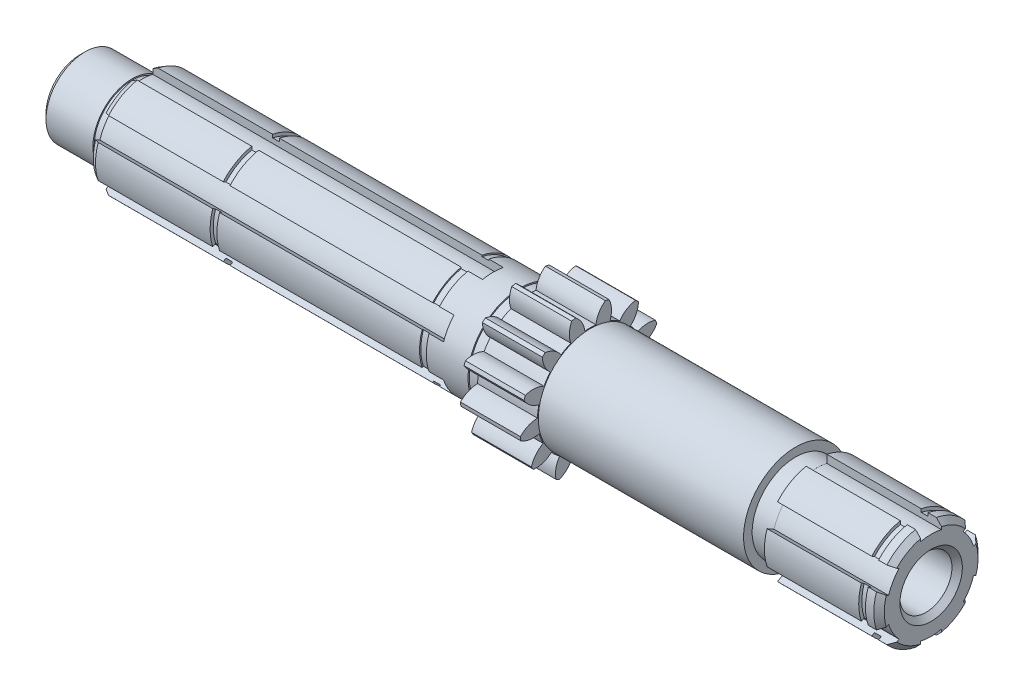
from build123d import *
from OCP.BRepFilletAPI import BRepFilletAPI_MakeChamfer

# Parameters (mm, degrees)
EXTRUDE_1_DEPTH     = 11.5
CUT_EXTRUDE_START   = -67.3
CUT_EXTRUDE_3_DEPTH = 67.3
CUT_EXTRUDE_4_DEPTH = 22
SKETCH_8_R          = 4
CUT_EXTRUDE_5_DEPTH = 165.506790732
SKETCH_9_R          = 5
CUT_EXTRUDE_7_DEPTH = 78.9
CHAMFER_1_SIZE      = 1
CHAMFER_2_SIZE      = 1
CHAMFER_3_SIZE      = 1
CHAMFER_3_SIZE2     = 0.577350269
SKETCH_10_R         = 1
CUT_EXTRUDE_8_DEPTH = 10


with BuildPart() as part:
    # 草图1 → 旋转1 (revolve)
    with BuildSketch(Plane.XY, mode=Mode.PRIVATE) as revolve_1_sk:
        Polygon((-80.983446533, 0), (-80.983446533, 7.5), (-70.983446533, 7.5), (-70.983446533, 7.25), (-68.983446533, 7.25), (-68.983446533, 10), (-45.983446533, 10), (-45.983446533, 9.4), (-44.683446533, 9.4), (-44.683446533, 10), (-5.783446533, 10), (-5.783446533, 9.75), (-4.483446533, 9.75), (-4.483446533, 10), (3.516553467, 10), (3.516553467, 9.75), (5.516553467, 9.75), (5.516553467, 0), align=None)
    revolve(revolve_1_sk.sketch.rotate(Axis((-46.880842637, 0, 0), (1, 0, 0)), 90), axis=Axis((-46.880842637, 0, 0), (1, 0, 0)))

    # 草图4 → 凸台-拉伸1 (add)
    with BuildSketch(Plane(origin=(5.516553467, 0, 0), x_dir=(0, 0, -1), z_dir=(1, 0, 0))):
        with BuildLine():
            ThreePointArc((2.866352313, 13.192195587), (1.644234537, 11.829106862), (1.058280139, 10.094678952))
            ThreePointArc((1.058280139, 10.094678952), (0, 10.15), (-1.058280139, 10.094678952))
            ThreePointArc((-1.058280139, 10.094678952), (-1.644234537, 11.829106862), (-2.866352313, 13.192195587))
            ThreePointArc((-2.866352313, 13.192195587), (-3.230761468, 13.107714535), (-3.592690052, 13.013169414))
            ThreePointArc((-3.592690052, 13.013169414), (-4.041362685, 11.238267839), (-3.754170697, 9.430201608))
            ThreePointArc((-3.754170697, 9.430201608), (-4.716940196, 8.98737866), (-5.62829175, 8.446587002))
            ThreePointArc((-5.62829175, 8.446587002), (-6.953157442, 9.710040059), (-8.668747907, 10.349048735))
            ThreePointArc((-8.668747907, 10.349048735), (-8.952155886, 10.1048951), (-9.228690423, 9.852982953))
            ThreePointArc((-9.228690423, 9.852982953), (-8.80113242, 8.072877089), (-7.70658627, 6.605378723))
            ThreePointArc((-7.70658627, 6.605378723), (-8.353286239, 5.765857179), (-8.908929548, 4.863483762))
            ThreePointArc((-8.908929548, 4.863483762), (-10.669195771, 5.366520098), (-12.485237825, 5.135059538))
            ThreePointArc((-12.485237825, 5.135059538), (-12.622719276, 4.787165975), (-12.750509036, 4.435596839))
            ThreePointArc((-12.750509036, 4.435596839), (-11.544668782, 3.058087488), (-9.893515802, 2.267343175))
            ThreePointArc((-9.893515802, 2.267343175), (-10.075995072, 1.223447305), (-10.148638952, 0.166215004))
            ThreePointArc((-10.148638952, 0.166215004), (-11.941049927, -0.206404945), (-13.441510221, -1.255309916))
            ThreePointArc((-13.441510221, -1.255309916), (-13.4015698, -1.627245183), (-13.351339689, -1.997931056))
            ThreePointArc((-13.351339689, -1.997931056), (-11.643460655, -2.657273104), (-9.813960094, -2.59011337))
            ThreePointArc((-9.813960094, -2.59011337), (-9.490414863, -3.599239603), (-9.063417476, -4.569131609))
            ThreePointArc((-9.063417476, -4.569131609), (-10.47735345, -5.732045102), (-11.318494613, -7.358102996))
            ThreePointArc((-11.318494613, -7.358102996), (-11.11028219, -7.668874081), (-10.89353932, -7.973757024))
            ThreePointArc((-10.89353932, -7.973757024), (-9.074876011, -7.76388445), (-7.4861444, -6.854206156))
            ThreePointArc((-7.4861444, -6.854206156), (-6.730694981, -7.597384094), (-5.901876282, -8.257745234))
            ThreePointArc((-5.901876282, -8.257745234), (-6.613421563, -9.944542805), (-6.602548292, -11.775243354))
            ThreePointArc((-6.602548292, -11.775243354), (-6.273762823, -11.953656346), (-5.940160375, -12.122891352))
            ThreePointArc((-5.940160375, -12.122891352), (-4.427346636, -11.091883435), (-3.443343241, -9.548082914))
            ThreePointArc((-3.443343241, -9.548082914), (-2.429053993, -9.855059447), (-1.388286357, -10.054608943))
            ThreePointArc((-1.388286357, -10.054608943), (-1.234434497, -11.878865596), (-0.374037726, -13.494817367))
            ThreePointArc((-0.374037726, -13.494817367), (0, -13.5), (0.374037726, -13.494817367))
            ThreePointArc((0.374037726, -13.494817367), (1.234434497, -11.878865596), (1.388286357, -10.054608943))
            ThreePointArc((1.388286357, -10.054608943), (2.429053993, -9.855059447), (3.443343241, -9.548082914))
            ThreePointArc((3.443343241, -9.548082914), (4.427346636, -11.091883435), (5.940160375, -12.122891352))
            ThreePointArc((5.940160375, -12.122891352), (6.273762823, -11.953656346), (6.602548292, -11.775243354))
            ThreePointArc((6.602548292, -11.775243354), (6.613421563, -9.944542805), (5.901876282, -8.257745234))
            ThreePointArc((5.901876282, -8.257745234), (6.730694981, -7.597384094), (7.4861444, -6.854206156))
            ThreePointArc((7.4861444, -6.854206156), (9.074876011, -7.76388445), (10.89353932, -7.973757024))
            ThreePointArc((10.89353932, -7.973757024), (11.11028219, -7.668874081), (11.318494613, -7.358102996))
            ThreePointArc((11.318494613, -7.358102996), (10.47735345, -5.732045102), (9.063417476, -4.569131609))
            ThreePointArc((9.063417476, -4.569131609), (9.490414863, -3.599239603), (9.813960094, -2.59011337))
            ThreePointArc((9.813960094, -2.59011337), (11.643460655, -2.657273104), (13.351339689, -1.997931056))
            ThreePointArc((13.351339689, -1.997931056), (13.4015698, -1.627245183), (13.441510221, -1.255309916))
            ThreePointArc((13.441510221, -1.255309916), (11.941049927, -0.206404945), (10.148638952, 0.166215004))
            ThreePointArc((10.148638952, 0.166215004), (10.075995072, 1.223447305), (9.893515802, 2.267343175))
            ThreePointArc((9.893515802, 2.267343175), (11.544668782, 3.058087488), (12.750509036, 4.435596839))
            ThreePointArc((12.750509036, 4.435596839), (12.622719276, 4.787165975), (12.485237825, 5.135059538))
            ThreePointArc((12.485237825, 5.135059538), (10.669195771, 5.366520098), (8.908929548, 4.863483762))
            ThreePointArc((8.908929548, 4.863483762), (8.353286239, 5.765857179), (7.70658627, 6.605378723))
            ThreePointArc((7.70658627, 6.605378723), (8.80113242, 8.072877089), (9.228690423, 9.852982953))
            ThreePointArc((9.228690423, 9.852982953), (8.952155886, 10.1048951), (8.668747907, 10.349048735))
            ThreePointArc((8.668747907, 10.349048735), (6.953157442, 9.710040059), (5.62829175, 8.446587002))
            ThreePointArc((5.62829175, 8.446587002), (4.716940196, 8.98737866), (3.754170697, 9.430201608))
            ThreePointArc((3.754170697, 9.430201608), (4.041362685, 11.238267839), (3.592690052, 13.013169414))
            ThreePointArc((3.592690052, 13.013169414), (3.230761468, 13.107714535), (2.866352313, 13.192195587))
        make_face()
    extrude(amount=EXTRUDE_1_DEPTH)

    # 草图5 → 旋转2 (revolve)
    with BuildSketch(Plane.XY, mode=Mode.PRIVATE) as revolve_2_sk:
        Polygon((12.003531279, 0), (17.016553467, 9.749991304), (14.016553467, 9.749991304), (14.016553467, 9.999991304), (56.416553467, 9.999991304), (56.416553467, 8.349991304), (60.416553467, 8.349991304), (60.416553467, 9.999991304), (78.516553467, 9.999991304), (78.516553467, 9.399991304), (79.816553467, 9.399991304), (79.816553467, 9.999991304), (82.416553467, 9.999991304), (82.416553467, 0), align=None)
    revolve(revolve_2_sk.sketch.rotate(Axis((82.416553467, 0, 0), (-1, 0, 0)), 90), axis=Axis((82.416553467, 0, 0), (-1, 0, 0)))

    # 草图6 → 切除-拉伸3 (cut)
    with BuildSketch(Plane.ZY.offset(68.983446533).offset(CUT_EXTRUDE_START)):
        with BuildLine():
            Line((7.485281374, 6.631030293), (6.154544011, 5.862728718))
            ThreePointArc((6.154544011, 5.862728718), (7.361215932, 4.25), (8.154544011, 2.398627103))
            Line((8.154544011, 2.398627103), (9.485281374, 3.166928678))
            ThreePointArc((9.485281374, 3.166928678), (8.660254038, 5), (7.485281374, 6.631030293))
        make_face()
        with BuildLine():
            Line((-2, 9.797958971), (-2, 8.261355821))
            ThreePointArc((-2, 8.261355821), (0, 8.5), (2, 8.261355821))
            Line((2, 8.261355821), (2, 9.797958971))
            ThreePointArc((2, 9.797958971), (0, 10), (-2, 9.797958971))
        make_face()
        with BuildLine():
            Line((9.485281374, -3.166928678), (8.154544011, -2.398627103))
            ThreePointArc((8.154544011, -2.398627103), (7.361215932, -4.25), (6.154544011, -5.862728718))
            Line((6.154544011, -5.862728718), (7.485281374, -6.631030293))
            ThreePointArc((7.485281374, -6.631030293), (8.660254038, -5), (9.485281374, -3.166928678))
        make_face()
        with BuildLine():
            Line((2, -9.797958971), (2, -8.261355821))
            ThreePointArc((2, -8.261355821), (0, -8.5), (-2, -8.261355821))
            Line((-2, -8.261355821), (-2, -9.797958971))
            ThreePointArc((-2, -9.797958971), (0, -10), (2, -9.797958971))
        make_face()
        with BuildLine():
            Line((-7.485281374, -6.631030293), (-6.154544011, -5.862728718))
            ThreePointArc((-6.154544011, -5.862728718), (-7.361215932, -4.25), (-8.154544011, -2.398627103))
            Line((-8.154544011, -2.398627103), (-9.485281374, -3.166928678))
            ThreePointArc((-9.485281374, -3.166928678), (-8.660254038, -5), (-7.485281374, -6.631030293))
        make_face()
        with BuildLine():
            Line((-9.485281374, 3.166928678), (-8.154544011, 2.398627103))
            ThreePointArc((-8.154544011, 2.398627103), (-7.361215932, 4.25), (-6.154544011, 5.862728718))
            Line((-6.154544011, 5.862728718), (-7.485281374, 6.631030293))
            ThreePointArc((-7.485281374, 6.631030293), (-8.660254038, 5), (-9.485281374, 3.166928678))
        make_face()
    extrude(amount=CUT_EXTRUDE_3_DEPTH, mode=Mode.SUBTRACT)

    # 草图7 → 切除-拉伸4 (cut)
    with BuildSketch(Plane(origin=(82.416553467, 0, 0), x_dir=(0, 0, -1), z_dir=(1, 0, 0))):
        with BuildLine():
            Line((7.485281374, 6.631030293), (6.154544011, 5.862728718))
            ThreePointArc((6.154544011, 5.862728718), (7.361215932, 4.25), (8.154544011, 2.398627103))
            Line((8.154544011, 2.398627103), (9.485281374, 3.166928678))
            ThreePointArc((9.485281374, 3.166928678), (8.660254038, 5), (7.485281374, 6.631030293))
        make_face()
        with BuildLine():
            Line((-2, 9.797958971), (-2, 8.261355821))
            ThreePointArc((-2, 8.261355821), (0, 8.5), (2, 8.261355821))
            Line((2, 8.261355821), (2, 9.797958971))
            ThreePointArc((2, 9.797958971), (0, 10), (-2, 9.797958971))
        make_face()
        with BuildLine():
            Line((9.485281374, -3.166928678), (8.154544011, -2.398627103))
            ThreePointArc((8.154544011, -2.398627103), (7.361215932, -4.25), (6.154544011, -5.862728718))
            Line((6.154544011, -5.862728718), (7.485281374, -6.631030293))
            ThreePointArc((7.485281374, -6.631030293), (8.660254038, -5), (9.485281374, -3.166928678))
        make_face()
        with BuildLine():
            Line((2, -9.797958971), (2, -8.261355821))
            ThreePointArc((2, -8.261355821), (0, -8.5), (-2, -8.261355821))
            Line((-2, -8.261355821), (-2, -9.797958971))
            ThreePointArc((-2, -9.797958971), (0, -10), (2, -9.797958971))
        make_face()
        with BuildLine():
            Line((-7.485281374, -6.631030293), (-6.154544011, -5.862728718))
            ThreePointArc((-6.154544011, -5.862728718), (-7.361215932, -4.25), (-8.154544011, -2.398627103))
            Line((-8.154544011, -2.398627103), (-9.485281374, -3.166928678))
            ThreePointArc((-9.485281374, -3.166928678), (-8.660254038, -5), (-7.485281374, -6.631030293))
        make_face()
        with BuildLine():
            Line((-9.485281374, 3.166928678), (-8.154544011, 2.398627103))
            ThreePointArc((-8.154544011, 2.398627103), (-7.361215932, 4.25), (-6.154544011, 5.862728718))
            Line((-6.154544011, 5.862728718), (-7.485281374, 6.631030293))
            ThreePointArc((-7.485281374, 6.631030293), (-8.660254038, 5), (-9.485281374, 3.166928678))
        make_face()
    extrude(amount=-CUT_EXTRUDE_4_DEPTH, mode=Mode.SUBTRACT)

    # 草图8 → 切除-拉伸5 (cut, through all)
    with BuildSketch(Plane.ZY.offset(80.983446533)):
        Circle(SKETCH_8_R)
    extrude(amount=-CUT_EXTRUDE_5_DEPTH, mode=Mode.SUBTRACT)

    # 草图9 → 切除-拉伸7 (cut)
    with BuildSketch(Plane(origin=(82.416553467, 0, 0), x_dir=(0, 0, -1), z_dir=(1, 0, 0))):
        Circle(SKETCH_9_R)
    extrude(amount=-CUT_EXTRUDE_7_DEPTH, mode=Mode.SUBTRACT)

    # 倒角1
    chamfer_1_edges = [part.edges().sort_by_distance(p)[0] for p in [
        (82.416553467, 0, 5),
        (82.416553467, 8.660246507, -4.999995652),
        (82.416553467, 0, -9.999991304),
        (82.416553467, -8.660246507, -4.999995652),
        (82.416553467, -8.660246507, 4.999995652),
        (82.416553467, 0, 9.999991304),
        (82.416553467, 8.660246507, 4.999995652),
    ]]
    chamfer(chamfer_1_edges, length=CHAMFER_1_SIZE)

    # 倒角2
    chamfer_2_edges = [part.edges().sort_by_distance(p)[0] for p in [
        (-80.983446533, 0, -7.5),
        (-80.983446533, 0, -4),
    ]]
    chamfer(chamfer_2_edges, length=CHAMFER_2_SIZE)

    # 倒角3: one chamfer whose edges measure the first distance from different faces: ONE call of the kernel's chamfer builder (chamfer() names one face for all edges)
    chamfer_3_edges_1 = [part.edges().sort_by_distance(p)[0] for p in [
        (-68.983446533, 8.660254038, -5),
    ]]
    chamfer_3_side_1 = [part.faces().sort_by_distance(p)[0] for p in [
        (-57.483446533, 8.660254038, -5),
    ]]
    chamfer_3_edges_2 = [part.edges().sort_by_distance(p)[0] for p in [
        (-68.983446533, 0, -10),
    ]]
    chamfer_3_side_2 = [part.faces().sort_by_distance(p)[0] for p in [
        (-57.483446533, 0, -10),
    ]]
    chamfer_3_edges_3 = [part.edges().sort_by_distance(p)[0] for p in [
        (-68.983446533, -8.660254038, -5),
    ]]
    chamfer_3_side_3 = [part.faces().sort_by_distance(p)[0] for p in [
        (-57.483446533, -8.660254038, -5),
    ]]
    chamfer_3_edges_4 = [part.edges().sort_by_distance(p)[0] for p in [
        (-68.983446533, -8.660254038, 5),
    ]]
    chamfer_3_side_4 = [part.faces().sort_by_distance(p)[0] for p in [
        (-57.483446533, -8.660254038, 5),
    ]]
    chamfer_3_edges_5 = [part.edges().sort_by_distance(p)[0] for p in [
        (-68.983446533, 0, 10),
    ]]
    chamfer_3_side_5 = [part.faces().sort_by_distance(p)[0] for p in [
        (-57.483446533, 0, 10),
    ]]
    chamfer_3_edges_6 = [part.edges().sort_by_distance(p)[0] for p in [
        (-68.983446533, 8.660254038, 5),
    ]]
    chamfer_3_side_6 = [part.faces().sort_by_distance(p)[0] for p in [
        (-57.483446533, 8.660254038, 5),
    ]]
    chamfer_3 = BRepFilletAPI_MakeChamfer(part.part.solid().wrapped)
    for e in chamfer_3_edges_1:
        chamfer_3.Add(CHAMFER_3_SIZE, CHAMFER_3_SIZE2, e.wrapped, chamfer_3_side_1[0].wrapped)  # the first distance lies on this face
    for e in chamfer_3_edges_2:
        chamfer_3.Add(CHAMFER_3_SIZE, CHAMFER_3_SIZE2, e.wrapped, chamfer_3_side_2[0].wrapped)  # the first distance lies on this face
    for e in chamfer_3_edges_3:
        chamfer_3.Add(CHAMFER_3_SIZE, CHAMFER_3_SIZE2, e.wrapped, chamfer_3_side_3[0].wrapped)  # the first distance lies on this face
    for e in chamfer_3_edges_4:
        chamfer_3.Add(CHAMFER_3_SIZE, CHAMFER_3_SIZE2, e.wrapped, chamfer_3_side_4[0].wrapped)  # the first distance lies on this face
    for e in chamfer_3_edges_5:
        chamfer_3.Add(CHAMFER_3_SIZE, CHAMFER_3_SIZE2, e.wrapped, chamfer_3_side_5[0].wrapped)  # the first distance lies on this face
    for e in chamfer_3_edges_6:
        chamfer_3.Add(CHAMFER_3_SIZE, CHAMFER_3_SIZE2, e.wrapped, chamfer_3_side_6[0].wrapped)  # the first distance lies on this face
    add(Compound.cast(chamfer_3.Shape()), mode=Mode.REPLACE)

    # 草图10 → 切除-拉伸8 (cut)
    with BuildSketch(Plane(origin=(0, 0, 0), x_dir=(1, 0, 0), z_dir=(0, 1, 0))):
        with Locations(Location((35.416553467, 0, 0), (0, 0, 270))):
            Circle(SKETCH_10_R)
        with Locations(Location((-51.983446533, 0, 0), (0, 0, 270))):
            Circle(SKETCH_10_R)
    extrude(amount=-CUT_EXTRUDE_8_DEPTH, mode=Mode.SUBTRACT)


solid = part.part
